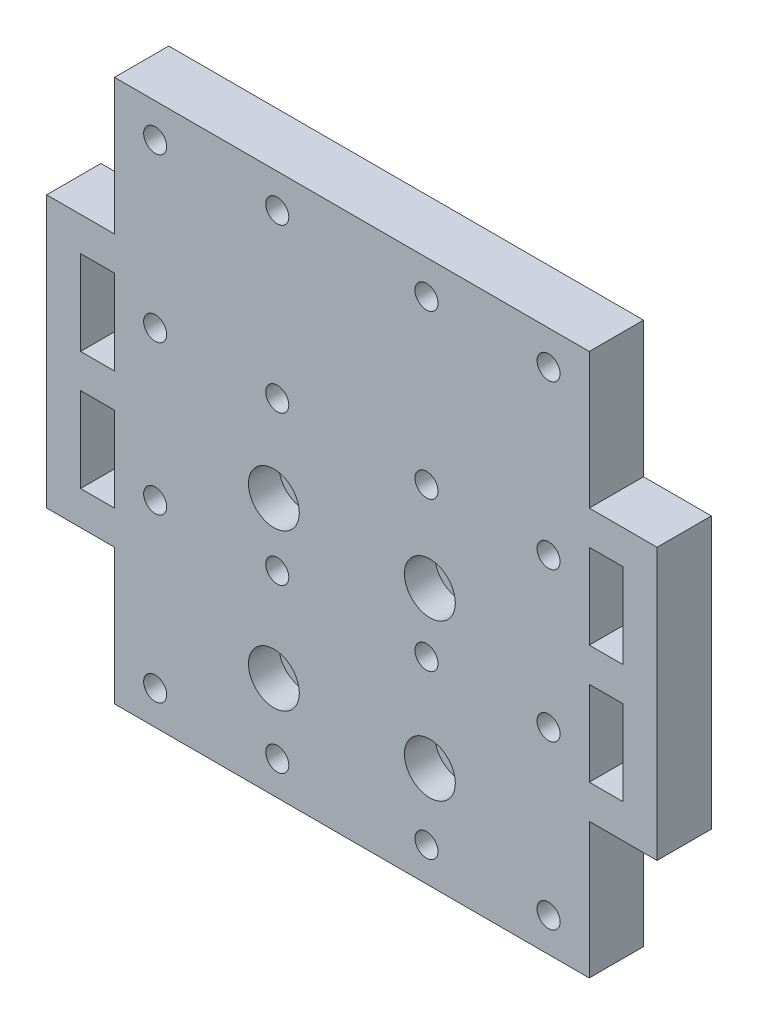
from build123d import *

# Parameters (mm, degrees)
SKETCH_1_W          = 70
SKETCH_1_H          = 80
SKETCH_1_R          = 1.7
EXTRUDE_1_DEPTH     = 8
SKETCH_2_R          = 3.75
CUT_EXTRUDE_1_DEPTH = 4.5
EXTRUDE_2_DEPTH     = 8
SKETCH_4_R          = 1.7
CUT_EXTRUDE_2_DEPTH = 20
SKETCH_6_R          = 3.75
CUT_EXTRUDE_4_DEPTH = 4.5
SKETCH_7_R          = 1.938201366
SKETCH_7_R_2        = 1.7
CUT_EXTRUDE_5_DEPTH = 10
SKETCH_8_R          = 3.75
CUT_EXTRUDE_6_DEPTH = 4.5


with BuildPart() as part:
    # 草图1 → 凸台-拉伸1 (new body)
    with BuildSketch(Plane.XY):
        with Locations((2.682119205, -17.951221502)):
            Rectangle(SKETCH_1_W, SKETCH_1_H)
        with Locations((-26.317880795, 17.048778498)):
            Circle(SKETCH_1_R, mode=Mode.SUBTRACT)
        with Locations((-8.317880795, 17.048778498)):
            Circle(SKETCH_1_R, mode=Mode.SUBTRACT)
        with Locations((-26.317880795, -6.951221502)):
            Circle(SKETCH_1_R, mode=Mode.SUBTRACT)
        with Locations((-8.317880795, -6.951221502)):
            Circle(SKETCH_1_R, mode=Mode.SUBTRACT)
        with Locations(Location((31.682119205, -6.951221502, 0), (0, 0, 180))):
            Circle(SKETCH_1_R, mode=Mode.SUBTRACT)
        with Locations(Location((13.682119205, -6.951221502, 0), (0, 0, 180))):
            Circle(SKETCH_1_R, mode=Mode.SUBTRACT)
        with Locations(Location((13.682119205, 17.048778498, 0), (0, 0, 180))):
            Circle(SKETCH_1_R, mode=Mode.SUBTRACT)
        with Locations(Location((31.682119205, 17.048778498, 0), (0, 0, 180))):
            Circle(SKETCH_1_R, mode=Mode.SUBTRACT)
        with Locations((13.682119205, -28.951221502)):
            Circle(SKETCH_1_R, mode=Mode.SUBTRACT)
        with Locations((31.682119205, -28.951221502)):
            Circle(SKETCH_1_R, mode=Mode.SUBTRACT)
        with Locations((31.682119205, -52.951221502)):
            Circle(SKETCH_1_R, mode=Mode.SUBTRACT)
        with Locations((13.682119205, -52.951221502)):
            Circle(SKETCH_1_R, mode=Mode.SUBTRACT)
        with Locations(Location((-26.317880795, -28.951221502, 0), (0, 0, 180))):
            Circle(SKETCH_1_R, mode=Mode.SUBTRACT)
        with Locations(Location((-8.317880795, -28.951221502, 0), (0, 0, 180))):
            Circle(SKETCH_1_R, mode=Mode.SUBTRACT)
        with Locations(Location((-8.317880795, -52.951221502, 0), (0, 0, 180))):
            Circle(SKETCH_1_R, mode=Mode.SUBTRACT)
        with Locations(Location((-26.317880795, -52.951221502, 0), (0, 0, 180))):
            Circle(SKETCH_1_R, mode=Mode.SUBTRACT)
    extrude(amount=EXTRUDE_1_DEPTH)

    # 草图2 → 切除-拉伸1 (cut)
    with BuildSketch(Plane(origin=(0, 0, 0), x_dir=(-1, 0, 0), z_dir=(0, 0, -1))):
        with Locations((-31.682119205, 17.048778498)):
            Circle(SKETCH_2_R)
        with Locations((-13.682119205, 17.048778498)):
            Circle(SKETCH_2_R)
        with Locations((8.317880795, 17.048778498)):
            Circle(SKETCH_2_R)
        with Locations((26.317880795, 17.048778498)):
            Circle(SKETCH_2_R)
        with Locations((-31.682119205, -6.951221502)):
            Circle(SKETCH_2_R)
        with Locations((-13.682119205, -6.951221502)):
            Circle(SKETCH_2_R)
        with Locations((8.317880795, -6.951221502)):
            Circle(SKETCH_2_R)
        with Locations((26.317880795, -6.951221502)):
            Circle(SKETCH_2_R)
        with Locations(Location((-31.682119205, -28.951221502, 0), (0, 0, 180))):
            Circle(SKETCH_2_R)
        with Locations(Location((-13.682119205, -28.951221502, 0), (0, 0, 180))):
            Circle(SKETCH_2_R)
        with Locations(Location((8.317880795, -28.951221502, 0), (0, 0, 180))):
            Circle(SKETCH_2_R)
        with Locations(Location((26.317880795, -28.951221502, 0), (0, 0, 180))):
            Circle(SKETCH_2_R)
        with Locations(Location((26.317880795, -52.951221502, 0), (0, 0, 180))):
            Circle(SKETCH_2_R)
        with Locations(Location((8.317880795, -52.951221502, 0), (0, 0, 180))):
            Circle(SKETCH_2_R)
        with Locations(Location((-13.682119205, -52.951221502, 0), (0, 0, 180))):
            Circle(SKETCH_2_R)
        with Locations(Location((-31.682119205, -52.951221502, 0), (0, 0, 180))):
            Circle(SKETCH_2_R)
    extrude(amount=-CUT_EXTRUDE_1_DEPTH, mode=Mode.SUBTRACT)

    # 草图3 → 凸台-拉伸2 (add)
    with BuildSketch(Plane.XY.offset(8)):
        Polygon((47.682119205, 2.048778498), (37.682119205, 2.048778498), (37.682119205, -2.951221502), (42.682119205, -2.951221502), (42.682119205, -15.451221502), (37.682119205, -15.451221502), (37.682119205, -20.451221502), (42.682119205, -20.451221502), (42.682119205, -32.951221502), (37.682119205, -32.951221502), (37.682119205, -37.951221502), (47.682119205, -37.951221502), align=None)
        Polygon((-32.317880795, -37.951221502), (-32.317880795, -32.951221502), (-37.317880795, -32.951221502), (-37.317880795, -20.451221502), (-32.317880795, -20.451221502), (-32.317880795, -15.451221502), (-37.317880795, -15.451221502), (-37.317880795, -2.951221502), (-32.317880795, -2.951221502), (-32.317880795, 2.048778498), (-42.317880795, 2.048778498), (-42.317880795, -37.951221502), align=None)
    extrude(amount=-EXTRUDE_2_DEPTH)

    # 草图4 → 切除-拉伸2 (cut)
    with BuildSketch(Plane.XY.offset(8)):
        with Locations((-8.817880795, -42.951221502)):
            Circle(SKETCH_4_R)
        with Locations((14.182119205, -42.951221502)):
            Circle(SKETCH_4_R)
    extrude(amount=-CUT_EXTRUDE_2_DEPTH, mode=Mode.SUBTRACT)

    # 草图6 → 切除-拉伸4 (cut)
    with BuildSketch(Plane.XY.offset(8)):
        with Locations((-8.817880795, -42.951221502)):
            Circle(SKETCH_6_R)
        with Locations((14.182119205, -42.951221502)):
            Circle(SKETCH_6_R)
    extrude(amount=-CUT_EXTRUDE_4_DEPTH, mode=Mode.SUBTRACT)

    # 草图7 → 切除-拉伸5 (cut)
    with BuildSketch(Plane(origin=(0, 0, 0), x_dir=(-1, 0, 0), z_dir=(0, 0, -1))):
        with Locations((-14.182119205, -19.951221502)):
            Circle(SKETCH_7_R)
        with Locations((8.817880795, -19.951221502)):
            Circle(SKETCH_7_R_2)
    extrude(amount=-CUT_EXTRUDE_5_DEPTH, mode=Mode.SUBTRACT)

    # 草图8 → 切除-拉伸6 (cut)
    with BuildSketch(Plane.XY.offset(8)):
        with Locations((-8.817880795, -19.951221502)):
            Circle(SKETCH_8_R)
        with Locations((14.182119205, -19.951221502)):
            Circle(SKETCH_8_R)
    extrude(amount=-CUT_EXTRUDE_6_DEPTH, mode=Mode.SUBTRACT)


solid = part.part
